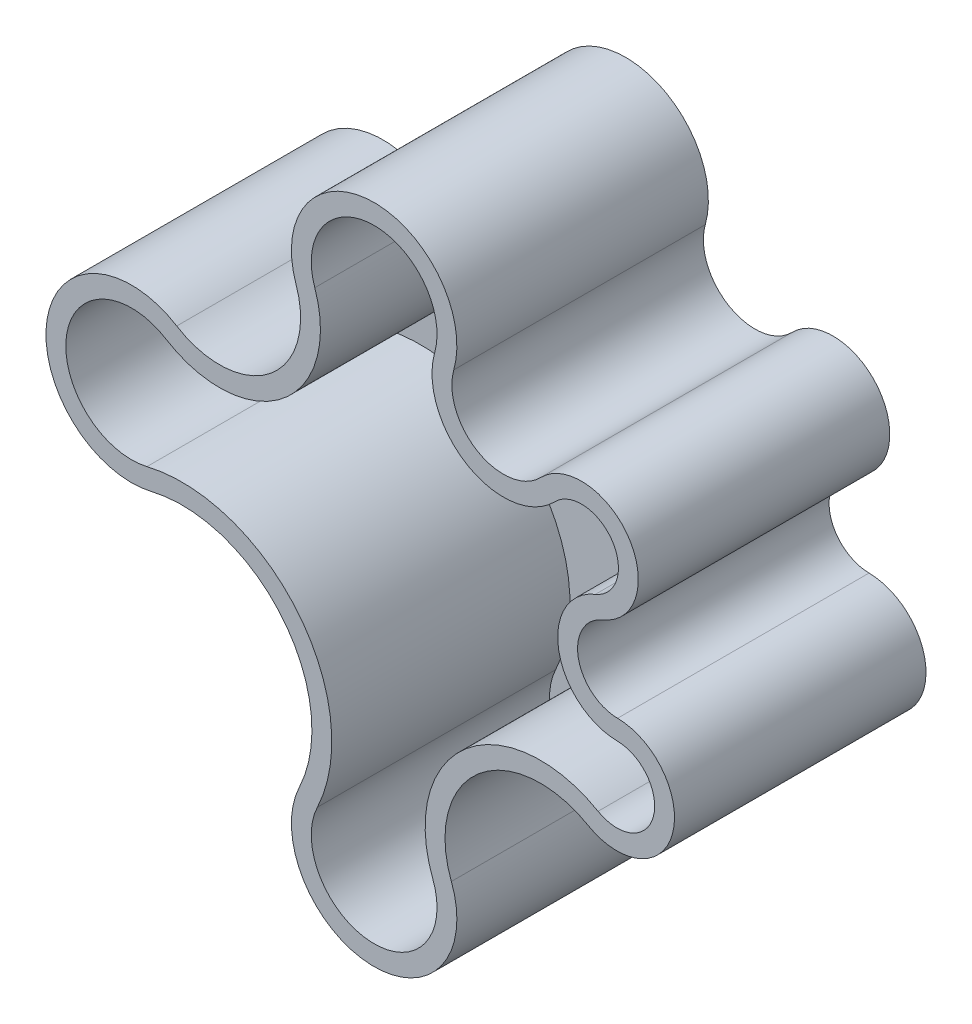
from build123d import *

# Parameters (mm, degrees)
BOSS_EXTRUDE2_DEPTH = 2
BOSS_EXTRUDE3_DEPTH = 36


with BuildPart() as part:
    # Sketch1 → Boss-Extrude2 (new body)
    with BuildSketch(Plane.XY):
        with BuildLine():
            ThreePointArc((36.77383834, 0.897309378), (30.841544287, 5.867048301), (34.547643901, 12.660813336))
            ThreePointArc((34.547643901, 12.660813336), (38.439664011, 25.419866138), (25.151092425, 26.583959838))
            ThreePointArc((25.151092425, 26.583959838), (15.658221947, 25.240839631), (12.033396672, 34.116604585))
            ThreePointArc((12.033396672, 34.116604585), (-0.388796102, 49.993952041), (-11.79974319, 33.374947194))
            ThreePointArc((-11.79974319, 33.374947194), (-15.701881175, 19.773765205), (-29.82628778, 18.925254505))
            ThreePointArc((-29.82628778, 18.925254505), (-49.422493782, 9.994241781), (-33.625891529, -4.642753649))
            ThreePointArc((-33.625891529, -4.642753649), (-13.793191326, -11.35592194), (-11.294565378, -32.144368111))
            ThreePointArc((-11.294565378, -32.144368111), (-0.472558297, -49.991064352), (11.666927416, -33.013040598))
            ThreePointArc((11.666927416, -33.013040598), (15.7550057, -16.875289061), (32.331827923, -15.342848629))
            ThreePointArc((32.331827923, -15.342848629), (45.072719303, -10.100170445), (36.77383834, 0.897309378))
        make_face()
    extrude(amount=BOSS_EXTRUDE2_DEPTH)

    # Sketch2 → Boss-Extrude3 (add)
    with BuildSketch(Plane.XY.offset(2)):
        with BuildLine():
            ThreePointArc((34.547643726, 12.660813265), (30.841544291, 5.867048278), (36.773838199, 0.89730938))
            ThreePointArc((36.773838199, 0.89730938), (45.072719321, -10.100170381), (32.331827916, -15.342848625))
            ThreePointArc((32.331827916, -15.342848625), (15.755005651, -16.875289103), (11.666927459, -33.013040709))
            ThreePointArc((11.666927459, -33.013040709), (-0.472558319, -49.991064352), (-11.29456541, -32.14436818))
            ThreePointArc((-11.29456541, -32.14436818), (-13.793191238, -11.355922049), (-33.62589133, -4.642753601))
            ThreePointArc((-33.62589133, -4.642753601), (-49.422493786, 9.994241754), (-29.826287652, 18.925254425))
            ThreePointArc((-29.826287652, 18.925254425), (-15.701881135, 19.773765237), (-11.799743174, 33.374947148))
            ThreePointArc((-11.799743174, 33.374947148), (-0.388796168, 49.993952038), (12.033396695, 34.116604666))
            ThreePointArc((12.033396695, 34.116604666), (15.65822203, 25.240839584), (25.151092616, 26.583960036))
            ThreePointArc((25.151092616, 26.583960036), (38.439664141, 25.419865946), (34.547643726, 12.660813265))
        make_face()
        with BuildLine():
            ThreePointArc((-31.408898966, 16.376658454), (-13.825543659, 17.432962452), (-8.967804812, 34.364959833))
            ThreePointArc((-8.967804812, 34.364959833), (-0.295485088, 46.995403549), (9.145381488, 34.928619546))
            ThreePointArc((9.145381488, 34.928619546), (14.164303925, 22.639261467), (27.308104459, 24.498942072))
            ThreePointArc((27.308104459, 24.498942072), (35.952987853, 23.741640383), (33.421033039, 15.4412356))
            ThreePointArc((33.421033039, 15.4412356), (27.893864073, 5.309211984), (36.741114762, -2.102512145))
            ThreePointArc((36.741114762, -2.102512145), (42.179011051, -9.308682891), (33.830458389, -12.743982198))
            ThreePointArc((33.830458389, -12.743982198), (13.805341223, -14.595199495), (8.866864868, -34.089910939))
            ThreePointArc((8.866864868, -34.089910939), (-0.359144322, -46.993208907), (-8.583869712, -33.429719817))
            ThreePointArc((-8.583869712, -33.429719817), (-11.464280061, -9.464844913), (-34.327373037, -1.725919116))
            ThreePointArc((-34.327373037, -1.725919116), (-46.460737086, 9.516751182), (-31.408898966, 16.376658454))
        make_face(mode=Mode.SUBTRACT)
    extrude(amount=BOSS_EXTRUDE3_DEPTH)


solid = part.part
